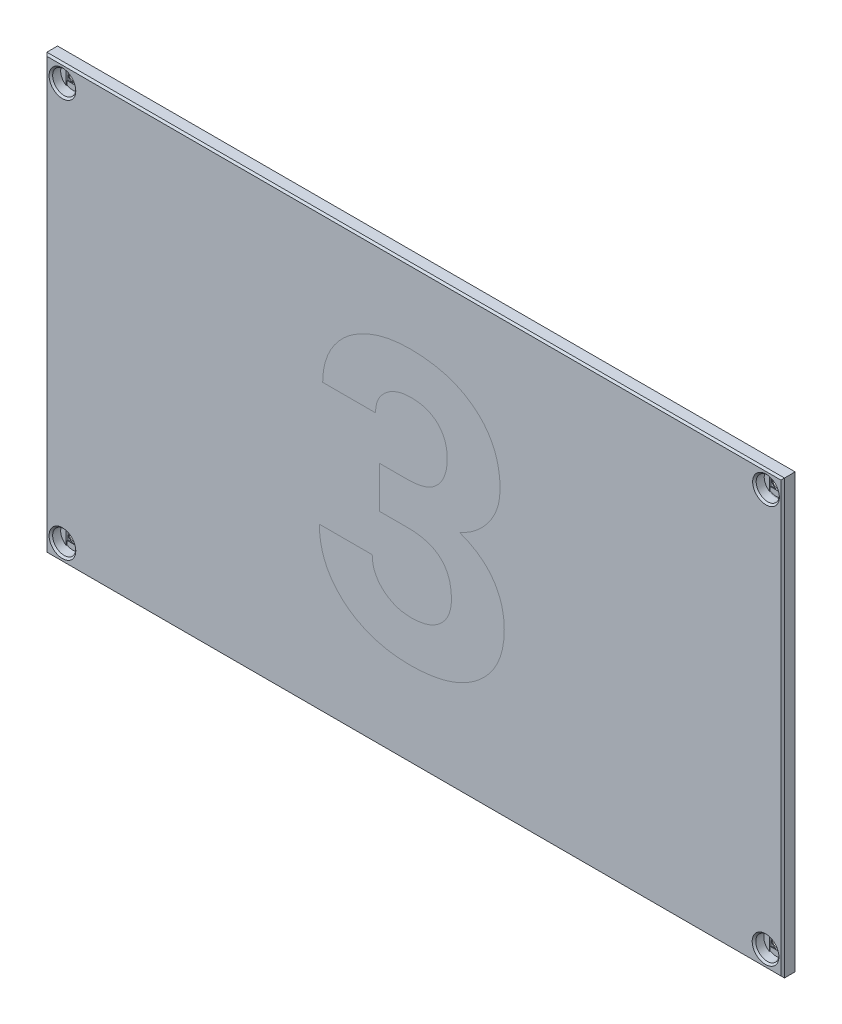
from build123d import *
from build123d.topology import SkipClean

# Parameters (mm, degrees)
SKETCH2_W               = 165.75
SKETCH2_H               = 97.3
SKETCH2_R               = 1.35
BOSS_EXTRUDE1_DEPTH     = 2.8
SKETCH3_R               = 2.6
CUT_EXTRUDE1_DEPTH      = 2.2
CUT_EXTRUDE2_DEPTH      = 0.2
SKETCH5_W               = 2.7
SKETCH5_H               = 2.7
CUT_EXTRUDE3_DEPTH      = 0.2
MIRROR2_COPY_1_DEPTH    = 0.2
MIRROR2_COPY_2_SKETCH_W = 2.7
MIRROR2_COPY_2_SKETCH_H = 2.7
MIRROR2_COPY_2_DEPTH    = 0.2
CHAMFER1_SIZE           = 0.4
CUT_EXTRUDE4_DEPTH      = 1
BOSS_EXTRUDE2_DEPTH     = 1


with BuildPart() as part:
    # Sketch2 → Boss-Extrude1 (new body)
    with BuildSketch(Plane.XY):
        with Locations((-0.025, -59.25)):
            Rectangle(SKETCH2_W, SKETCH2_H)
        with Locations((-79, -14.5)):
            Circle(SKETCH2_R, mode=Mode.SUBTRACT)
        with Locations((79.1, -14.5)):
            Circle(SKETCH2_R, mode=Mode.SUBTRACT)
        with Locations((79, -104)):
            Circle(SKETCH2_R, mode=Mode.SUBTRACT)
        with Locations((-79, -104)):
            Circle(SKETCH2_R, mode=Mode.SUBTRACT)
    extrude(amount=BOSS_EXTRUDE1_DEPTH)

    # Sketch3 → Cut-Extrude1 (cut)
    with BuildSketch(Plane.XY.offset(2.8)):
        with Locations((-79, -14.5)):
            Circle(SKETCH3_R)
        with Locations((-79, -104)):
            Circle(SKETCH3_R)
        with Locations((79, -104)):
            Circle(SKETCH3_R)
        with Locations((79.1, -14.5)):
            Circle(SKETCH3_R)
    extrude(amount=-CUT_EXTRUDE1_DEPTH, mode=Mode.SUBTRACT)

    # Sketch4 → Cut-Extrude2 (cut)
    with SkipClean():  # the faces are left unmerged after this step: merging them gives an invalid solid
        with BuildSketch(Plane.XY.offset(0.6)):
            with BuildLine():
                Line((-80.35, -16.722048604), (-80.35, -12.277951396))
                ThreePointArc((-80.35, -12.277951396), (-79, -11.9), (-77.65, -12.277951396))
                Line((-77.65, -12.277951396), (-77.65, -16.722048604))
                ThreePointArc((-77.65, -16.722048604), (-79, -17.1), (-80.35, -16.722048604))
            make_face()
        cut_extrude2 = extrude(amount=-CUT_EXTRUDE2_DEPTH, mode=Mode.SUBTRACT)

    # Sketch5 → Cut-Extrude3 (cut)
    with SkipClean():  # the faces are left unmerged after this step: merging them gives an invalid solid
        with BuildSketch(Plane.XY.offset(0.4)):
            with Locations((-79, -14.5)):
                Rectangle(SKETCH5_W, SKETCH5_H)
        cut_extrude3 = extrude(amount=-CUT_EXTRUDE3_DEPTH, mode=Mode.SUBTRACT)

    # Mirror1: Cut-Extrude2, Cut-Extrude3 across plane
    with SkipClean():  # the faces are left unmerged after this step: merging them gives an invalid solid
        add(cut_extrude2.mirror(Plane.ZX.offset(-59.25)), mode=Mode.SUBTRACT)
        add(cut_extrude3.mirror(Plane.ZX.offset(-59.25)), mode=Mode.SUBTRACT)

    # Mirror2: Cut-Extrude2, Cut-Extrude3 across plane
    with SkipClean():  # the faces are left unmerged after this step: merging them gives an invalid solid
        add(cut_extrude2.mirror(Plane(origin=(0, 0, 0), x_dir=(0, 0, 1), z_dir=(1, 0, 0))), mode=Mode.SUBTRACT)
        add(cut_extrude3.mirror(Plane(origin=(0, 0, 0), x_dir=(0, 0, 1), z_dir=(1, 0, 0))), mode=Mode.SUBTRACT)

    # Mirror2 copy 1 sketch → Mirror2 copy 1 (cut)
    with SkipClean():  # the faces are left unmerged after this step: merging them gives an invalid solid
        with BuildSketch(Plane(origin=(0, -118.5, 0.6), x_dir=(-1, 0, 0), z_dir=(0, 0, 1))):
            with BuildLine():
                Line((-80.35, -16.722048604), (-80.35, -12.277951396))
                ThreePointArc((-80.35, -12.277951396), (-79, -11.9), (-77.65, -12.277951396))
                Line((-77.65, -12.277951396), (-77.65, -16.722048604))
                ThreePointArc((-77.65, -16.722048604), (-79, -17.1), (-80.35, -16.722048604))
            make_face()
        extrude(amount=-MIRROR2_COPY_1_DEPTH, mode=Mode.SUBTRACT)

    # Mirror2 copy 2 sketch → Mirror2 copy 2 (cut)
    with SkipClean():  # the faces are left unmerged after this step: merging them gives an invalid solid
        with BuildSketch(Plane(origin=(0, -118.5, 0.4), x_dir=(-1, 0, 0), z_dir=(0, 0, 1))):
            with Locations((-79, -14.5)):
                Rectangle(MIRROR2_COPY_2_SKETCH_W, MIRROR2_COPY_2_SKETCH_H)
        extrude(amount=-MIRROR2_COPY_2_DEPTH, mode=Mode.SUBTRACT)

    # Chamfer1
    chamfer1_edges = [part.edges().sort_by_distance(p)[0] for p in [
        (82.85, -59.25, 2.8),
        (-0.025, -10.6, 2.8),
        (76.5, -14.5, 2.8),
        (76.4, -104, 2.8),
        (-81.6, -104, 2.8),
        (-81.6, -14.5, 2.8),
        (-82.9, -59.25, 2.8),
        (-0.025, -107.9, 2.8),
    ]]
    chamfer(chamfer1_edges, length=CHAMFER1_SIZE)

    # Sketch6 → Cut-Extrude4 (cut)
    with SkipClean():  # the faces are left unmerged after this step: merging them gives an invalid solid
        with BuildSketch(Plane.XY.offset(2.8)):
            with BuildLine():
                Line((-7.743344156, -52.835064935), (-1.412175325, -52.835064935))
                add(Edge.make_bspline(
                    [(-1.412175325, -52.835064935), (-1.046646214, -52.828425688), (-0.338194455, -52.815557805), (0.6842895, -52.706476392), (1.633214203, -52.522878561), (2.512052434, -52.271617942), (3.316428438, -51.938151458), (4.05918236, -51.556696514), (4.709231751, -51.068221231), (5.483945567, -50.344878944), (6.287059938, -49.275104317), (6.974478067, -47.795033013), (7.398414129, -46.125336487), (7.441342881, -44.948062611), (7.463636364, -44.336688312)],
                    knots=[0, 0, 0, 0, 0.940287213, 1.822421551, 2.641556821, 3.424694542, 4.169293387, 4.879338255, 5.566439646, 6.253461691, 7.602561486, 8.975851533, 10.429518664, 12, 12, 12, 12], degree=3))
                add(Edge.make_bspline(
                    [(7.463636364, -44.336688312), (7.440977131, -43.745686094), (7.397871234, -42.621390304), (6.989453761, -41.031592262), (6.30173968, -39.655415464), (5.345227927, -38.494752315), (4.141731261, -37.591508452), (2.736073848, -36.913043473), (1.109975354, -36.547627681), (-0.034670624, -36.497584932), (-0.632954545, -36.471428571)],
                    knots=[0, 0, 0, 0, 1.106911191, 2.105737598, 3.052108258, 3.971176241, 4.89987119, 5.853196066, 6.877907842, 8, 8, 8, 8], degree=3))
                add(Edge.make_bspline(
                    [(-0.632954545, -36.471428571), (-1.179183592, -36.49273542), (-2.240068866, -36.53411755), (-3.758056977, -36.915226072), (-5.150716612, -37.508013578), (-6.363562494, -38.367387006), (-7.381145104, -39.401395474), (-8.126363371, -40.618262378), (-8.564513573, -41.994228578), (-8.617188853, -42.961758415), (-8.644318182, -43.460064935)],
                    knots=[0, 0, 0, 0, 1.100997141, 2.138355073, 3.1400221, 4.14017996, 5.119479477, 6.049734185, 6.995555347, 8, 8, 8, 8], degree=3))
                Line((-8.644318182, -43.460064935), (-20.51525974, -43.460064935))
                add(Edge.make_bspline(
                    [(-20.51525974, -43.460064935), (-20.486863982, -42.694273326), (-20.431157861, -41.191961605), (-19.930271339, -39.007222907), (-19.155552533, -36.934500147), (-18.031678592, -35.011054683), (-16.644503342, -33.238893532), (-14.98043261, -31.667024588), (-13.062829593, -30.310084939), (-10.916891516, -29.177835257), (-8.601809716, -28.249932661), (-6.140793221, -27.596592795), (-3.56406428, -27.196936347), (-1.807304097, -27.146470143), (-0.912987013, -27.120779221)],
                    knots=[0, 0, 0, 0, 0.966541855, 1.896138765, 2.81820615, 3.753375261, 4.699395705, 5.653556373, 6.635542708, 7.658915773, 8.713245169, 9.780716377, 10.870225271, 12, 12, 12, 12], degree=3))
                add(Edge.make_bspline(
                    [(-0.912987013, -27.120779221), (-0.145339424, -27.133723928), (1.352638194, -27.158984062), (3.536637801, -27.386829375), (5.598357101, -27.730049845), (7.530734235, -28.22812286), (9.332486907, -28.875925372), (11.008427198, -29.6647041), (12.55025819, -30.610877257), (13.964067838, -31.680331151), (15.239618185, -32.872076268), (16.335300182, -34.194365228), (17.273434047, -35.616537565), (18.026879588, -37.153504602), (18.633723766, -38.7906881), (19.033942282, -40.543135415), (19.303106145, -42.396551034), (19.331937635, -43.670083858), (19.346753247, -44.324512987)],
                    knots=[0, 0, 0, 0, 1.224991411, 2.390432464, 3.501245437, 4.55869672, 5.570992791, 6.553328135, 7.509928521, 8.453164671, 9.378886224, 10.289616824, 11.188006457, 12.091914663, 13.01620709, 13.968410301, 14.956028888, 16, 16, 16, 16], degree=3))
                add(Edge.make_bspline(
                    [(19.346753247, -44.324512987), (19.315921124, -45.004868087), (19.254819134, -46.353171339), (18.774500543, -48.334432769), (17.973902166, -50.221471764), (16.868008755, -51.996053938), (15.526082709, -53.630982457), (13.964766194, -55.07838285), (12.209391923, -56.327461709), (10.91876078, -56.974921403), (10.263961039, -57.303409091)],
                    knots=[0, 0, 0, 0, 0.975199875, 1.932616016, 2.905780507, 3.904301247, 4.921820077, 5.931094337, 6.950343869, 8, 8, 8, 8], degree=3))
                add(Edge.make_bspline(
                    [(10.263961039, -57.303409091), (10.672137933, -57.456037107), (11.475000627, -57.756248467), (12.620898022, -58.29656739), (13.689697355, -58.88610304), (14.669705285, -59.540264252), (15.582520176, -60.23327116), (16.404741526, -61.000619436), (17.152699728, -61.817167702), (17.810889414, -62.688989668), (18.400574337, -63.600985346), (18.895604444, -64.567477407), (19.325873035, -65.571304069), (19.67998554, -66.616618111), (19.94508045, -67.705425972), (20.1396069, -68.832041621), (20.26708064, -69.999344372), (20.278479965, -70.793332635), (20.284253247, -71.195454545)],
                    knots=[0, 0, 0, 0, 1.135591366, 2.233649077, 3.299270688, 4.314544607, 5.302778425, 6.283508287, 7.242132893, 8.185871394, 9.127947963, 10.069608592, 11.012872554, 11.973072167, 12.943014361, 13.930964977, 14.952120131, 16, 16, 16, 16], degree=3))
                add(Edge.make_bspline(
                    [(20.284253247, -71.195454545), (20.271277141, -71.841977977), (20.245928339, -73.104960433), (19.947911532, -74.947182184), (19.508397474, -76.69406485), (18.867371494, -78.346486437), (18.037164024, -79.893119997), (17.0249384, -81.344517709), (15.842602949, -82.702306901), (14.473262076, -83.935850405), (12.970926204, -85.059792802), (11.324681308, -86.015566042), (9.579960993, -86.855784942), (7.703932863, -87.519027843), (5.717621323, -88.046703342), (3.609716792, -88.399685989), (1.389840669, -88.644528775), (-0.133055664, -88.667471146), (-0.912987013, -88.679220779)],
                    knots=[0, 0, 0, 0, 1.003278088, 1.959902087, 2.891033978, 3.797118873, 4.705240828, 5.611062544, 6.540314738, 7.495254887, 8.4685776, 9.449160904, 10.44733635, 11.472245039, 12.534920097, 13.635545947, 14.78907592, 16, 16, 16, 16], degree=3))
                add(Edge.make_bspline(
                    [(-0.912987013, -88.679220779), (-1.64399733, -88.665487508), (-3.072916651, -88.63864283), (-5.167019686, -88.420081037), (-7.15464667, -88.035863128), (-9.051258361, -87.537018097), (-10.833806517, -86.855120276), (-12.528658052, -86.056005704), (-14.113058773, -85.089107003), (-15.58326086, -83.98659629), (-16.910918686, -82.759466733), (-18.074322882, -81.424986827), (-19.072792292, -79.999052756), (-19.861876177, -78.461739197), (-20.489792568, -76.842219781), (-20.940045317, -75.127789942), (-21.214369558, -73.314736113), (-21.243220819, -72.073059112), (-21.257954545, -71.438961039)],
                    knots=[0, 0, 0, 0, 1.171598283, 2.29014473, 3.36950937, 4.414187089, 5.42911288, 6.424227277, 7.413819201, 8.398717381, 9.365400831, 10.305991257, 11.231706883, 12.148234037, 13.068792433, 14.010799022, 14.984157308, 16, 16, 16, 16], degree=3))
                Line((-21.257954545, -71.438961039), (-9.387012987, -71.438961039))
                add(Edge.make_bspline(
                    [(-9.387012987, -71.438961039), (-9.381758943, -71.723623952), (-9.371499141, -72.279497655), (-9.238938581, -73.093699916), (-9.053306584, -73.872612918), (-8.768404659, -74.605943896), (-8.409513445, -75.300080766), (-7.973244006, -75.953920738), (-7.45475228, -76.57060432), (-6.66426599, -77.323606076), (-5.543747339, -78.129940737), (-4.037637434, -78.831311591), (-2.381450431, -79.262232343), (-1.228167595, -79.305988653), (-0.632954545, -79.328571429)],
                    knots=[0, 0, 0, 0, 0.77706506, 1.517408881, 2.249062136, 2.961723651, 3.66114464, 4.380933377, 5.105151625, 5.858179978, 7.36018841, 8.853655635, 10.376161367, 12, 12, 12, 12], degree=3))
                add(Edge.make_bspline(
                    [(-0.632954545, -79.328571429), (-0.287618823, -79.322310146), (0.384585546, -79.310122409), (1.360454395, -79.194114377), (2.278753645, -79.030501026), (3.138461215, -78.783544052), (3.944126642, -78.470260413), (4.688374616, -78.077441476), (5.379008107, -77.622639425), (6.011526662, -77.103600484), (6.570229698, -76.511932614), (7.071873217, -75.885585049), (7.488640402, -75.20523794), (7.835877831, -74.48551762), (8.083963585, -73.708439723), (8.284890717, -72.896518653), (8.392681302, -72.03437932), (8.406325323, -71.447342887), (8.413311688, -71.146753247)],
                    knots=[0, 0, 0, 0, 1.202513374, 2.340721478, 3.419418457, 4.448710458, 5.451641282, 6.425551161, 7.374511498, 8.328513943, 9.268479192, 10.204715462, 11.118914472, 12.042251348, 12.981152685, 13.955062564, 14.952898025, 16, 16, 16, 16], degree=3))
                add(Edge.make_bspline(
                    [(8.413311688, -71.146753247), (8.408242934, -70.785053914), (8.398359142, -70.079760022), (8.266324146, -69.064081303), (8.09745214, -68.10864884), (7.807631016, -67.237274925), (7.470647788, -66.419924241), (7.046745508, -65.677804813), (6.536633453, -65.013349612), (5.9648666, -64.406907124), (5.296821856, -63.887981112), (4.567033336, -63.413872445), (3.740122962, -63.04669736), (2.850986568, -62.724173167), (1.882321746, -62.488672095), (0.842854551, -62.297888021), (-0.278366621, -62.209961886), (-1.050882241, -62.193956507), (-1.448701299, -62.185714286)],
                    knots=[0, 0, 0, 0, 1.135341772, 2.213854287, 3.214012647, 4.177668881, 5.091722311, 5.988360184, 6.852785097, 7.718431415, 8.598510045, 9.503987335, 10.445201109, 11.433177415, 12.4721564, 13.572600939, 14.74997271, 16, 16, 16, 16], degree=3))
                Line((-1.448701299, -62.185714286), (-7.743344156, -62.185714286))
                Line((-7.743344156, -62.185714286), (-7.743344156, -52.835064935))
            make_face()
        extrude(amount=-CUT_EXTRUDE4_DEPTH, mode=Mode.SUBTRACT)


with BuildPart() as body_2:
    # Sketch6<2> → Boss-Extrude2 (new body)
    with BuildSketch(Plane.XY.offset(2.8)):
        with BuildLine():
            Line((-7.743344156, -52.835064935), (-1.412175325, -52.835064935))
            add(Edge.make_bspline(
                [(-1.412175325, -52.835064935), (-1.046646214, -52.828425688), (-0.338194455, -52.815557805), (0.6842895, -52.706476392), (1.633214203, -52.522878561), (2.512052434, -52.271617942), (3.316428438, -51.938151458), (4.05918236, -51.556696514), (4.709231751, -51.068221231), (5.483945567, -50.344878944), (6.287059938, -49.275104317), (6.974478067, -47.795033013), (7.398414129, -46.125336487), (7.441342881, -44.948062611), (7.463636364, -44.336688312)],
                knots=[0, 0, 0, 0, 0.940287213, 1.822421551, 2.641556821, 3.424694542, 4.169293387, 4.879338255, 5.566439646, 6.253461691, 7.602561486, 8.975851533, 10.429518664, 12, 12, 12, 12], degree=3))
            add(Edge.make_bspline(
                [(7.463636364, -44.336688312), (7.440977131, -43.745686094), (7.397871234, -42.621390304), (6.989453761, -41.031592262), (6.30173968, -39.655415464), (5.345227927, -38.494752315), (4.141731261, -37.591508452), (2.736073848, -36.913043473), (1.109975354, -36.547627681), (-0.034670624, -36.497584932), (-0.632954545, -36.471428571)],
                knots=[0, 0, 0, 0, 1.106911191, 2.105737598, 3.052108258, 3.971176241, 4.89987119, 5.853196066, 6.877907842, 8, 8, 8, 8], degree=3))
            add(Edge.make_bspline(
                [(-0.632954545, -36.471428571), (-1.179183592, -36.49273542), (-2.240068866, -36.53411755), (-3.758056977, -36.915226072), (-5.150716612, -37.508013578), (-6.363562494, -38.367387006), (-7.381145104, -39.401395474), (-8.126363371, -40.618262378), (-8.564513573, -41.994228578), (-8.617188853, -42.961758415), (-8.644318182, -43.460064935)],
                knots=[0, 0, 0, 0, 1.100997141, 2.138355073, 3.1400221, 4.14017996, 5.119479477, 6.049734185, 6.995555347, 8, 8, 8, 8], degree=3))
            Line((-8.644318182, -43.460064935), (-20.51525974, -43.460064935))
            add(Edge.make_bspline(
                [(-20.51525974, -43.460064935), (-20.486863982, -42.694273326), (-20.431157861, -41.191961605), (-19.930271339, -39.007222907), (-19.155552533, -36.934500147), (-18.031678592, -35.011054683), (-16.644503342, -33.238893532), (-14.98043261, -31.667024588), (-13.062829593, -30.310084939), (-10.916891516, -29.177835257), (-8.601809716, -28.249932661), (-6.140793221, -27.596592795), (-3.56406428, -27.196936347), (-1.807304097, -27.146470143), (-0.912987013, -27.120779221)],
                knots=[0, 0, 0, 0, 0.966541855, 1.896138765, 2.81820615, 3.753375261, 4.699395705, 5.653556373, 6.635542708, 7.658915773, 8.713245169, 9.780716377, 10.870225271, 12, 12, 12, 12], degree=3))
            add(Edge.make_bspline(
                [(-0.912987013, -27.120779221), (-0.145339424, -27.133723928), (1.352638194, -27.158984062), (3.536637801, -27.386829375), (5.598357101, -27.730049845), (7.530734235, -28.22812286), (9.332486907, -28.875925372), (11.008427198, -29.6647041), (12.55025819, -30.610877257), (13.964067838, -31.680331151), (15.239618185, -32.872076268), (16.335300182, -34.194365228), (17.273434047, -35.616537565), (18.026879588, -37.153504602), (18.633723766, -38.7906881), (19.033942282, -40.543135415), (19.303106145, -42.396551034), (19.331937635, -43.670083858), (19.346753247, -44.324512987)],
                knots=[0, 0, 0, 0, 1.224991411, 2.390432464, 3.501245437, 4.55869672, 5.570992791, 6.553328135, 7.509928521, 8.453164671, 9.378886224, 10.289616824, 11.188006457, 12.091914663, 13.01620709, 13.968410301, 14.956028888, 16, 16, 16, 16], degree=3))
            add(Edge.make_bspline(
                [(19.346753247, -44.324512987), (19.315921124, -45.004868087), (19.254819134, -46.353171339), (18.774500543, -48.334432769), (17.973902166, -50.221471764), (16.868008755, -51.996053938), (15.526082709, -53.630982457), (13.964766194, -55.07838285), (12.209391923, -56.327461709), (10.91876078, -56.974921403), (10.263961039, -57.303409091)],
                knots=[0, 0, 0, 0, 0.975199875, 1.932616016, 2.905780507, 3.904301247, 4.921820077, 5.931094337, 6.950343869, 8, 8, 8, 8], degree=3))
            add(Edge.make_bspline(
                [(10.263961039, -57.303409091), (10.672137933, -57.456037107), (11.475000627, -57.756248467), (12.620898022, -58.29656739), (13.689697355, -58.88610304), (14.669705285, -59.540264252), (15.582520176, -60.23327116), (16.404741526, -61.000619436), (17.152699728, -61.817167702), (17.810889414, -62.688989668), (18.400574337, -63.600985346), (18.895604444, -64.567477407), (19.325873035, -65.571304069), (19.67998554, -66.616618111), (19.94508045, -67.705425972), (20.1396069, -68.832041621), (20.26708064, -69.999344372), (20.278479965, -70.793332635), (20.284253247, -71.195454545)],
                knots=[0, 0, 0, 0, 1.135591366, 2.233649077, 3.299270688, 4.314544607, 5.302778425, 6.283508287, 7.242132893, 8.185871394, 9.127947963, 10.069608592, 11.012872554, 11.973072167, 12.943014361, 13.930964977, 14.952120131, 16, 16, 16, 16], degree=3))
            add(Edge.make_bspline(
                [(20.284253247, -71.195454545), (20.271277141, -71.841977977), (20.245928339, -73.104960433), (19.947911532, -74.947182184), (19.508397474, -76.69406485), (18.867371494, -78.346486437), (18.037164024, -79.893119997), (17.0249384, -81.344517709), (15.842602949, -82.702306901), (14.473262076, -83.935850405), (12.970926204, -85.059792802), (11.324681308, -86.015566042), (9.579960993, -86.855784942), (7.703932863, -87.519027843), (5.717621323, -88.046703342), (3.609716792, -88.399685989), (1.389840669, -88.644528775), (-0.133055664, -88.667471146), (-0.912987013, -88.679220779)],
                knots=[0, 0, 0, 0, 1.003278088, 1.959902087, 2.891033978, 3.797118873, 4.705240828, 5.611062544, 6.540314738, 7.495254887, 8.4685776, 9.449160904, 10.44733635, 11.472245039, 12.534920097, 13.635545947, 14.78907592, 16, 16, 16, 16], degree=3))
            add(Edge.make_bspline(
                [(-0.912987013, -88.679220779), (-1.64399733, -88.665487508), (-3.072916651, -88.63864283), (-5.167019686, -88.420081037), (-7.15464667, -88.035863128), (-9.051258361, -87.537018097), (-10.833806517, -86.855120276), (-12.528658052, -86.056005704), (-14.113058773, -85.089107003), (-15.58326086, -83.98659629), (-16.910918686, -82.759466733), (-18.074322882, -81.424986827), (-19.072792292, -79.999052756), (-19.861876177, -78.461739197), (-20.489792568, -76.842219781), (-20.940045317, -75.127789942), (-21.214369558, -73.314736113), (-21.243220819, -72.073059112), (-21.257954545, -71.438961039)],
                knots=[0, 0, 0, 0, 1.171598283, 2.29014473, 3.36950937, 4.414187089, 5.42911288, 6.424227277, 7.413819201, 8.398717381, 9.365400831, 10.305991257, 11.231706883, 12.148234037, 13.068792433, 14.010799022, 14.984157308, 16, 16, 16, 16], degree=3))
            Line((-21.257954545, -71.438961039), (-9.387012987, -71.438961039))
            add(Edge.make_bspline(
                [(-9.387012987, -71.438961039), (-9.381758943, -71.723623952), (-9.371499141, -72.279497655), (-9.238938581, -73.093699916), (-9.053306584, -73.872612918), (-8.768404659, -74.605943896), (-8.409513445, -75.300080766), (-7.973244006, -75.953920738), (-7.45475228, -76.57060432), (-6.66426599, -77.323606076), (-5.543747339, -78.129940737), (-4.037637434, -78.831311591), (-2.381450431, -79.262232343), (-1.228167595, -79.305988653), (-0.632954545, -79.328571429)],
                knots=[0, 0, 0, 0, 0.77706506, 1.517408881, 2.249062136, 2.961723651, 3.66114464, 4.380933377, 5.105151625, 5.858179978, 7.36018841, 8.853655635, 10.376161367, 12, 12, 12, 12], degree=3))
            add(Edge.make_bspline(
                [(-0.632954545, -79.328571429), (-0.287618823, -79.322310146), (0.384585546, -79.310122409), (1.360454395, -79.194114377), (2.278753645, -79.030501026), (3.138461215, -78.783544052), (3.944126642, -78.470260413), (4.688374616, -78.077441476), (5.379008107, -77.622639425), (6.011526662, -77.103600484), (6.570229698, -76.511932614), (7.071873217, -75.885585049), (7.488640402, -75.20523794), (7.835877831, -74.48551762), (8.083963585, -73.708439723), (8.284890717, -72.896518653), (8.392681302, -72.03437932), (8.406325323, -71.447342887), (8.413311688, -71.146753247)],
                knots=[0, 0, 0, 0, 1.202513374, 2.340721478, 3.419418457, 4.448710458, 5.451641282, 6.425551161, 7.374511498, 8.328513943, 9.268479192, 10.204715462, 11.118914472, 12.042251348, 12.981152685, 13.955062564, 14.952898025, 16, 16, 16, 16], degree=3))
            add(Edge.make_bspline(
                [(8.413311688, -71.146753247), (8.408242934, -70.785053914), (8.398359142, -70.079760022), (8.266324146, -69.064081303), (8.09745214, -68.10864884), (7.807631016, -67.237274925), (7.470647788, -66.419924241), (7.046745508, -65.677804813), (6.536633453, -65.013349612), (5.9648666, -64.406907124), (5.296821856, -63.887981112), (4.567033336, -63.413872445), (3.740122962, -63.04669736), (2.850986568, -62.724173167), (1.882321746, -62.488672095), (0.842854551, -62.297888021), (-0.278366621, -62.209961886), (-1.050882241, -62.193956507), (-1.448701299, -62.185714286)],
                knots=[0, 0, 0, 0, 1.135341772, 2.213854287, 3.214012647, 4.177668881, 5.091722311, 5.988360184, 6.852785097, 7.718431415, 8.598510045, 9.503987335, 10.445201109, 11.433177415, 12.4721564, 13.572600939, 14.74997271, 16, 16, 16, 16], degree=3))
            Line((-1.448701299, -62.185714286), (-7.743344156, -62.185714286))
            Line((-7.743344156, -62.185714286), (-7.743344156, -52.835064935))
        make_face()
    extrude(amount=-BOSS_EXTRUDE2_DEPTH)


solid = Compound([part.part, body_2.part])
